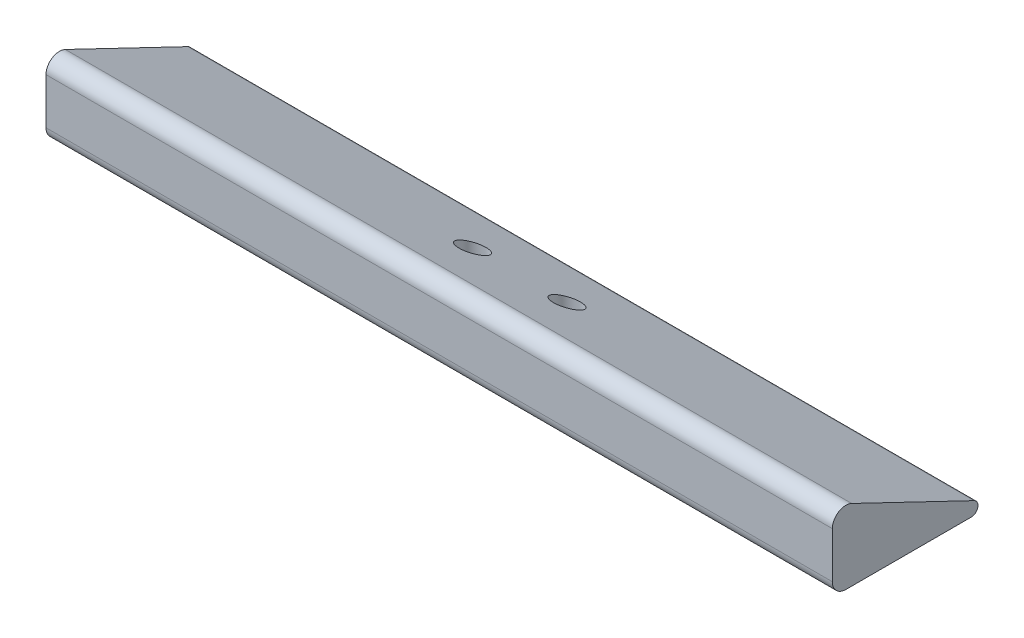
from build123d import *

# Parameters (mm, degrees)
BOSS_EXTRUDE1_DEPTH = 116.65
SKETCH2_R           = 2
CUT_EXTRUDE1_DEPTH  = 8
SKETCH3_R           = 1.5
CUT_EXTRUDE2_DEPTH  = 119.961552208


with BuildPart() as part:
    # Sketch1 → Boss-Extrude1 (new body)
    with BuildSketch(Plane(origin=(0, 0, 0), x_dir=(0, 0, -1), z_dir=(1, 0, 0))):
        with BuildLine():
            Line((2, 0), (20.605762563, 0))
            ThreePointArc((20.605762563, 0), (21.580832575, 0.778102566), (21.03849363, 1.901523057))
            Line((21.03849363, 1.901523057), (2.865462135, 10.624578175))
            ThreePointArc((2.865462135, 10.624578175), (0.934853125, 10.514299657), (0, 8.82153206))
            Line((0, 8.82153206), (0, 2))
            ThreePointArc((0, 2), (0.585786438, 0.585786438), (2, 0))
        make_face()
    extrude(amount=BOSS_EXTRUDE1_DEPTH)

    # Sketch2 → Cut-Extrude1 (cut)
    with BuildSketch(Plane(origin=(0, 10, 0), x_dir=(1, 0, 0), z_dir=(0, 1, 0))):
        with Locations(Location((51.325, 11.951977883, 0), (0, 0, 270))):
            Circle(SKETCH2_R)
        with Locations(Location((65.325, 11.951977883, 0), (0, 0, 270))):
            Circle(SKETCH2_R)
    extrude(amount=-CUT_EXTRUDE1_DEPTH, mode=Mode.SUBTRACT)

    # Sketch3 → Cut-Extrude2 (cut, through all)
    with BuildSketch(Plane(origin=(0, 2, 0), x_dir=(1, 0, 0), z_dir=(0, 1, 0))):
        with Locations(Location((51.325, 11.951977883, 0), (0, 0, 270))):
            Circle(SKETCH3_R)
        with Locations(Location((65.325, 11.951977883, 0), (0, 0, 270))):
            Circle(SKETCH3_R)
    extrude(amount=-CUT_EXTRUDE2_DEPTH, mode=Mode.SUBTRACT)


solid = part.part
